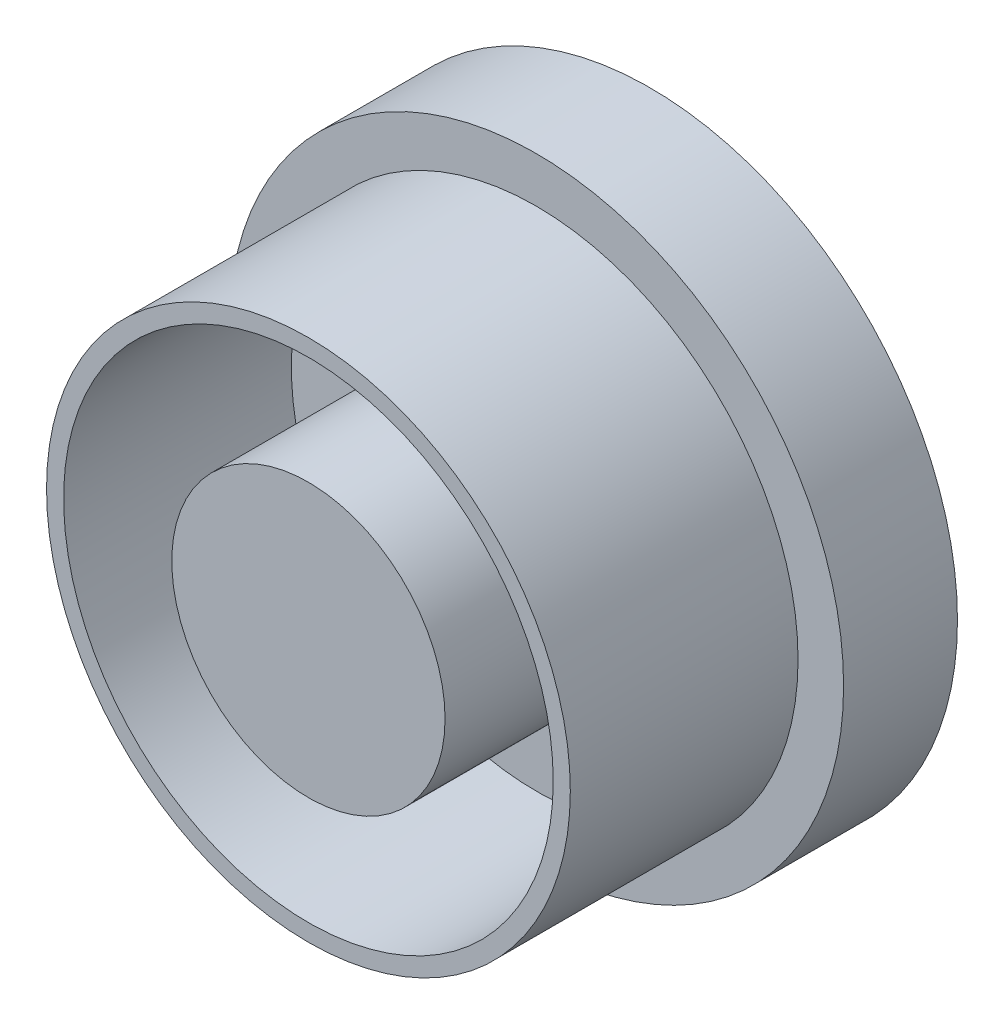
from build123d import *

# Parameters (mm, degrees)
SKETCH1_R           = 13.5
BOSS_EXTRUDE1_DEPTH = 5
SKETCH2_R           = 11.5
SKETCH2_R_2         = 10.75
BOSS_EXTRUDE2_DEPTH = 10
SKETCH3_R           = 6
BOSS_EXTRUDE3_DEPTH = 10


with BuildPart() as part:
    # Sketch1 → Boss-Extrude1 (new body)
    with BuildSketch(Plane.XY):
        Circle(SKETCH1_R)
    extrude(amount=BOSS_EXTRUDE1_DEPTH)

    # Sketch2 → Boss-Extrude2 (add)
    with BuildSketch(Plane.XY.offset(5)):
        Circle(SKETCH2_R)
        Circle(SKETCH2_R_2, mode=Mode.SUBTRACT)
    extrude(amount=BOSS_EXTRUDE2_DEPTH)

    # Sketch3 → Boss-Extrude3 (add)
    with BuildSketch(Plane.XY.offset(5)):
        Circle(SKETCH3_R)
    extrude(amount=BOSS_EXTRUDE3_DEPTH)


solid = part.part
